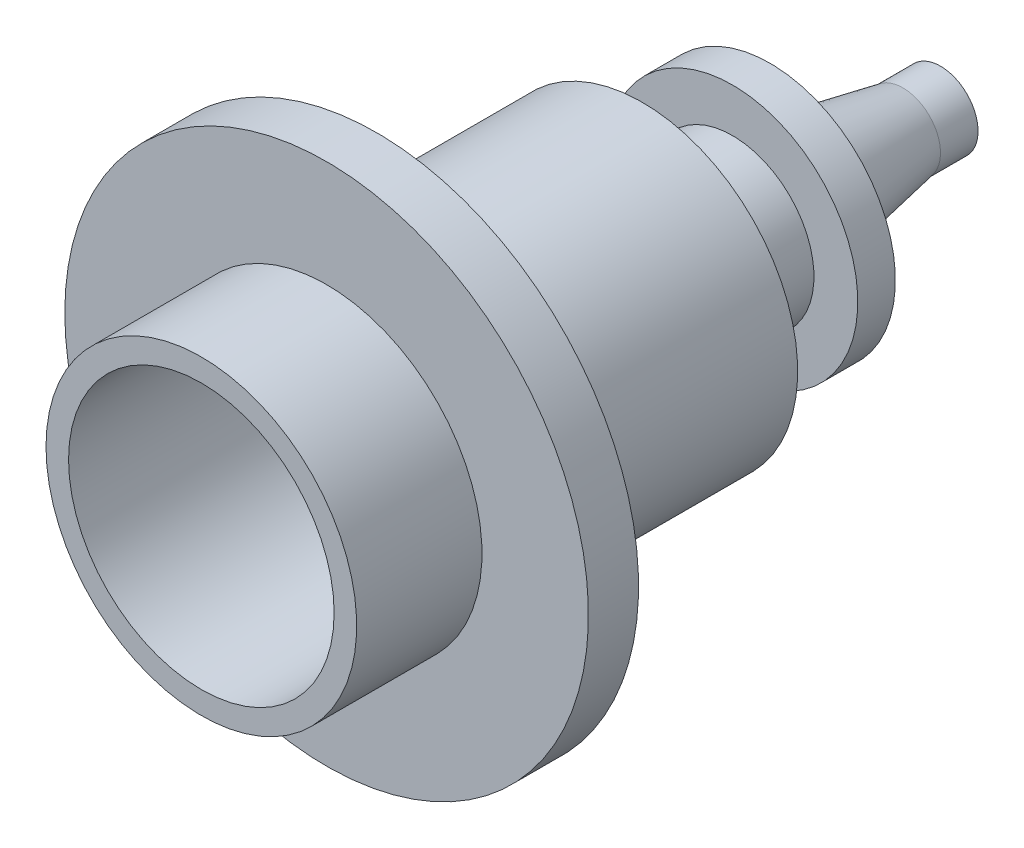
from build123d import *


with BuildPart() as part:
    # Body Sketch → Body Revolve (revolve)
    with BuildSketch(Plane(origin=(0, 0, 0), x_dir=(1, 0, 0), z_dir=(0, 1, 0)), mode=Mode.PRIVATE) as body_revolve_sk:
        Polygon((2.65, -14.75), (3.1, -14.75), (3.1, -12.25), (5.225, -12.25), (5.225, -11.25), (3.1, -11.25), (3.1, -5.95), (1.625, -5.55), (1.625, -4.15), (2.5, -4.15), (2.5, -3.4), (0.25, -3.4), (0.25, -5.954207714), (2.65, -6.605055172), align=None)
    revolve(body_revolve_sk.sketch.rotate(Axis((0, 0, 0), (0, 0, 1)), 180), axis=Axis((0, 0, 0), (0, 0, 1)))

    # N08 Sketch → N08 Revolve (revolve)
    with BuildSketch(Plane(origin=(0, 0, 0), x_dir=(1, 0, 0), z_dir=(0, 1, 0)), mode=Mode.PRIVATE) as n08_revolve_sk:
        Polygon((0.5, 0), (0.75, 0), (0.75, -0.75), (1.25, -3.4), (0.5, -3.4), align=None)
    revolve(n08_revolve_sk.sketch.rotate(Axis((0, 0, 0), (0, 0, 1)), 180), axis=Axis((0, 0, 0), (0, 0, 1)))


solid = part.part
